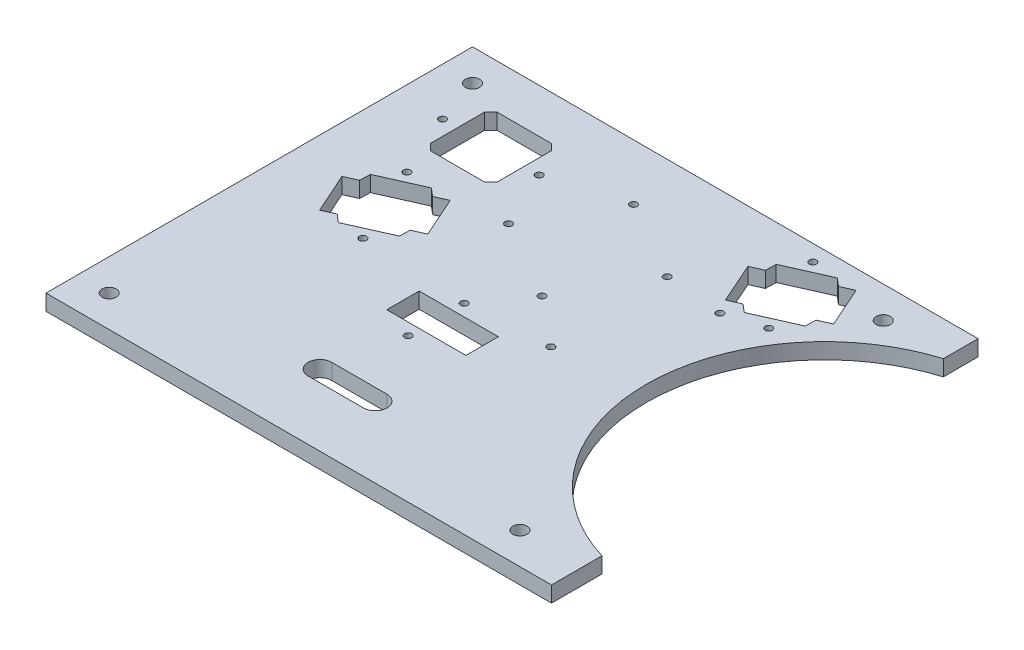
from build123d import *

# Parameters (mm, degrees)
SCHIZZO1_W                   = 320
SCHIZZO1_H                   = 270
ESTRUSIONE_ESTRUSIONE1_DEPTH = 10
SCHIZZO3_R                   = 2.25
TAGLIO_ESTRUSIONE2_DEPTH     = 10
SCHIZZO4_R                   = 2.25
TAGLIO_ESTRUSIONE3_DEPTH     = 33
FORO_PER_VITE_M8_1_D         = 9
FORO_PER_VITE_M8_1_DEPTH     = 188
FORO_PER_VITE_M8_1_TIP       = 2.703872786
SCHIZZO7_R                   = 113
TAGLIO_ESTRUSIONE4_DEPTH     = 10
TAGLIO_ESTRUSIONE5_DEPTH     = 22
SCHIZZO9_R                   = 2.25
TAGLIO_ESTRUSIONE6_DEPTH     = 42.3
SCHIZZO10_W                  = 50.1
SCHIZZO10_H                  = 20.5
TAGLIO_ESTRUSIONE7_DEPTH     = 42.3
SCHIZZO11_R                  = 2.25
TAGLIO_ESTRUSIONE8_DEPTH     = 18
SCHIZZO12_R                  = 2.25
TAGLIO_ESTRUSIONE9_DEPTH     = 179
TAGLIO_ESTRUSIONE10_DEPTH    = 179


with BuildPart() as part:
    # Schizzo1 → Estrusione-Estrusione1 (new body)
    with BuildSketch(Plane(origin=(0, 0, 0), x_dir=(1, 0, 0), z_dir=(0, 1, 0))):
        with Locations((-160, 135)):
            Rectangle(SCHIZZO1_W, SCHIZZO1_H)
    extrude(amount=ESTRUSIONE_ESTRUSIONE1_DEPTH)

    # Schizzo3 → Taglio-Estrusione2 (cut)
    with BuildSketch(Plane(origin=(0, 10, 0), x_dir=(1, 0, 0), z_dir=(0, 1, 0))):
        with Locations(Location((-132.397041122, 205.611580849, 0), (0, 0, 270))):
            Circle(SCHIZZO3_R)
        with Locations(Location((-161.388419151, 155.397041122, 0), (0, 0, 270))):
            Circle(SCHIZZO3_R)
        with Locations(Location((-182.611580849, 234.602958878, 0), (0, 0, 270))):
            Circle(SCHIZZO3_R)
        with Locations(Location((-211.602958878, 184.388419151, 0), (0, 0, 270))):
            Circle(SCHIZZO3_R)
    extrude(amount=-TAGLIO_ESTRUSIONE2_DEPTH, mode=Mode.SUBTRACT)

    # Schizzo4 → Taglio-Estrusione3 (cut)
    with BuildSketch(Plane(origin=(0, 10, 0), x_dir=(1, 0, 0), z_dir=(0, 1, 0))):
        with Locations(Location((-272.0814314, 180.543373533, 0), (0, 0, 270))):
            Circle(SCHIZZO4_R)
        with Locations(Location((-249.710916031, 130.298373362, 0), (0, 0, 270))):
            Circle(SCHIZZO4_R)
        with Locations(Location((-94.289083758, 259.701626731, 0), (0, 0, 270))):
            Circle(SCHIZZO4_R)
        with Locations(Location((-71.918568389, 209.456626561, 0), (0, 0, 270))):
            Circle(SCHIZZO4_R)
        Polygon((-112.499215416, 236.816363994), (-104.785184586, 240.250871799), (-104.615474565, 246.89424924), (-77.861643306, 258.805822358), (-72.811093568, 254.486654307), (-65.097062738, 257.921162112), (-53.708436732, 232.341889298), (-61.422467562, 228.907381493), (-61.592177583, 222.264004053), (-88.346008842, 210.352430934), (-93.396558579, 214.671598985), (-101.110589409, 211.23709118), align=None)
        Polygon((-242.88941038, 178.762908913), (-231.500784374, 153.183636099), (-239.214815204, 149.749128294), (-239.384525224, 143.105750854), (-266.138356484, 131.194177735), (-271.188906221, 135.513345787), (-278.902937051, 132.078837982), (-290.291563058, 157.658110796), (-282.577532228, 161.092618601), (-282.407822207, 167.735996041), (-255.653990947, 179.64756916), (-250.60344121, 175.328401108), align=None)
    extrude(amount=-TAGLIO_ESTRUSIONE3_DEPTH, mode=Mode.SUBTRACT)

    # Foro per Vite M8-1
    with Locations(Plane(origin=(0, 10, 0), x_dir=(1, 0, 0), z_dir=(0, 1, 0))):
        with Locations((-300, 20), (-300, 250), (-40, 250), (-40, 20)):
            Hole(FORO_PER_VITE_M8_1_D / 2, depth=FORO_PER_VITE_M8_1_DEPTH)
            with Locations((0, 0, -(FORO_PER_VITE_M8_1_DEPTH + FORO_PER_VITE_M8_1_TIP / 2))):  # 118° drill point
                Cone(0, FORO_PER_VITE_M8_1_D / 2, FORO_PER_VITE_M8_1_TIP, mode=Mode.SUBTRACT)

    # Schizzo7 → Taglio-Estrusione4 (cut)
    with BuildSketch(Plane(origin=(0, 10, 0), x_dir=(1, 0, 0), z_dir=(0, 1, 0))):
        with Locations((33, 140)):
            Circle(SCHIZZO7_R)
    extrude(amount=-TAGLIO_ESTRUSIONE4_DEPTH, mode=Mode.SUBTRACT)

    # Schizzo8 → Taglio-Estrusione5 (cut)
    with BuildSketch(Plane(origin=(0, 10, 0), x_dir=(1, 0, 0), z_dir=(0, 1, 0))):
        Polygon((-280.401232083, 238), (-276.401232083, 242), (-242.101232083, 242), (-238.101232083, 238), (-238.101232083, 203.7), (-242.101232083, 199.7), (-276.401232083, 199.7), (-280.401232083, 203.7), align=None)
    extrude(amount=-TAGLIO_ESTRUSIONE5_DEPTH, mode=Mode.SUBTRACT)

    # Schizzo9 → Taglio-Estrusione6 (cut)
    with BuildSketch(Plane(origin=(0, 10, 0), x_dir=(1, 0, 0), z_dir=(0, 1, 0))):
        with Locations(Location((-228.601232, 220.85, 0), (0, 0, 270))):
            Circle(SCHIZZO9_R)
        with Locations(Location((-289.901232, 220.85, 0), (0, 0, 270))):
            Circle(SCHIZZO9_R)
    extrude(amount=-TAGLIO_ESTRUSIONE6_DEPTH, mode=Mode.SUBTRACT)

    # Schizzo10 → Taglio-Estrusione7 (cut)
    with BuildSketch(Plane(origin=(0, 10, 0), x_dir=(1, 0, 0), z_dir=(0, 1, 0))):
        with Locations((-177.95, 109)):
            Rectangle(SCHIZZO10_W, SCHIZZO10_H)
    extrude(amount=-TAGLIO_ESTRUSIONE7_DEPTH, mode=Mode.SUBTRACT)

    # Schizzo11 → Taglio-Estrusione8 (cut)
    with BuildSketch(Plane(origin=(0, 10, 0), x_dir=(1, 0, 0), z_dir=(0, 1, 0))):
        with Locations(Location((-182, 91.25, 0), (0, 0, 270))):
            Circle(SCHIZZO11_R)
        with Locations(Location((-182, 126.75, 0), (0, 0, 270))):
            Circle(SCHIZZO11_R)
    extrude(amount=-TAGLIO_ESTRUSIONE8_DEPTH, mode=Mode.SUBTRACT)

    # Schizzo12 → Taglio-Estrusione9 (cut)
    with BuildSketch(Plane(origin=(0, 10, 0), x_dir=(1, 0, 0), z_dir=(0, 1, 0))):
        with Locations(Location((-95.652024181, 202.266681741, 0), (0, 0, 270))):
            Circle(SCHIZZO12_R)
        with Locations(Location((-130.721715924, 130.363158037, 0), (0, 0, 270))):
            Circle(SCHIZZO12_R)
    extrude(amount=-TAGLIO_ESTRUSIONE9_DEPTH, mode=Mode.SUBTRACT)

    # Schizzo13 → Taglio-Estrusione10 (cut)
    with BuildSketch(Plane(origin=(0, 10, 0), x_dir=(1, 0, 0), z_dir=(0, 1, 0))):
        with BuildLine():
            Line((-191.594117082, 52.5), (-156.594117082, 52.5))
            ThreePointArc((-156.594117082, 52.5), (-149.094117082, 45), (-156.594117082, 37.5))
            Line((-156.594117082, 37.5), (-191.594117082, 37.5))
            ThreePointArc((-191.594117082, 37.5), (-199.094117082, 45), (-191.594117082, 52.5))
        make_face()
    extrude(amount=-TAGLIO_ESTRUSIONE10_DEPTH, mode=Mode.SUBTRACT)


solid = part.part
